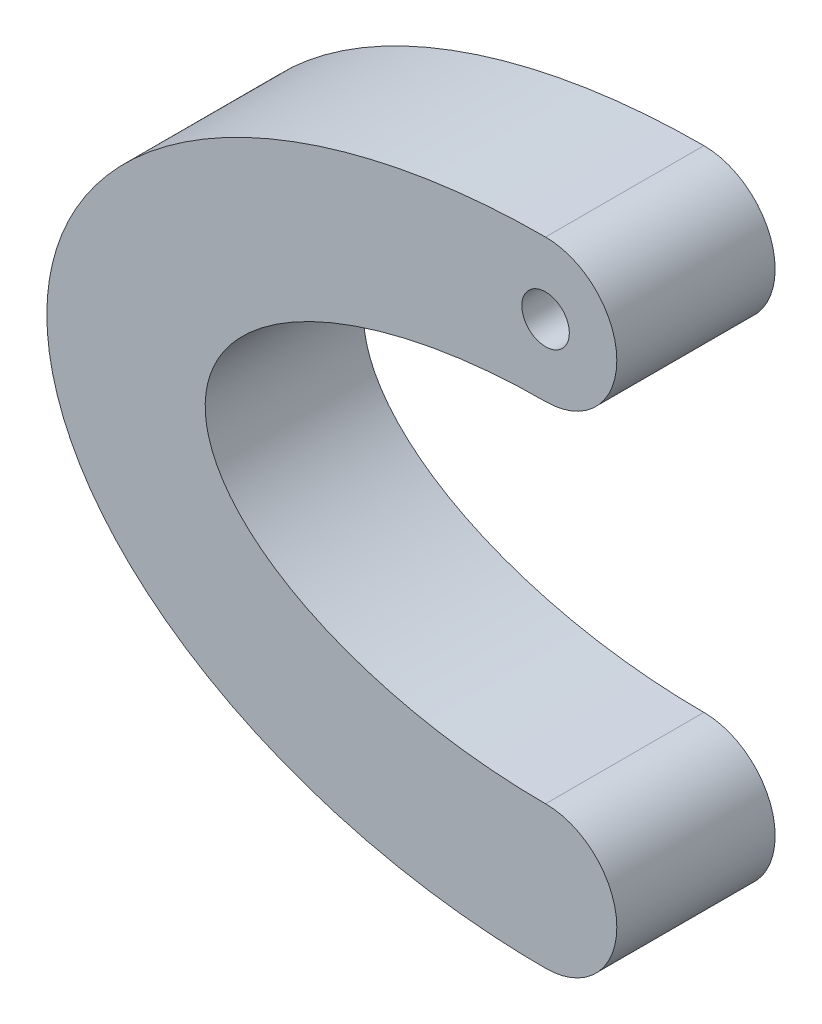
from build123d import *

# Parameters (mm, degrees)
SKETCH1_R           = 1.5
BOSS_EXTRUDE1_DEPTH = 10


with BuildPart() as part:
    # Sketch1 → Boss-Extrude1 (new body)
    with BuildSketch(Plane.XY):
        with BuildLine():
            add(Edge.make_bspline(
                [(0, 11), (-21.5, 11), (-21.5, 0), (-21.5, -11), (0, -11)],
                knots=[4.71238898, 4.71238898, 4.71238898, 6.283185307, 6.283185307, 7.853981634, 7.853981634, 7.853981634], degree=2, weights=[1, 0.707106781, 1, 0.707106781, 1]))
            ThreePointArc((0, -11), (4.5, -15.5), (0, -20))
            add(Edge.make_bspline(
                [(0, 20), (-31.5, 20), (-31.5, 0), (-31.5, -20), (0, -20)],
                knots=[4.71238898, 4.71238898, 4.71238898, 6.283185307, 6.283185307, 7.853981634, 7.853981634, 7.853981634], degree=2, weights=[1, 0.707106781, 1, 0.707106781, 1]))
            ThreePointArc((0, 20), (4.5, 15.5), (0, 11))
        make_face()
        with Locations((0, 15.5)):
            Circle(SKETCH1_R, mode=Mode.SUBTRACT)
    extrude(amount=-BOSS_EXTRUDE1_DEPTH)


solid = part.part
